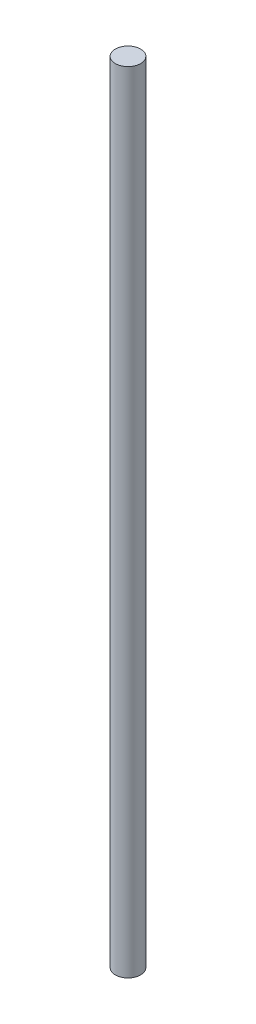
from build123d import *

# Parameters (mm, degrees)
SKETCH1_R           = 4
BOSS_EXTRUDE4_DEPTH = 250


with BuildPart() as part:
    # Sketch1 → Boss-Extrude4 (new body)
    with BuildSketch(Plane(origin=(0, 0, 0), x_dir=(1, 0, 0), z_dir=(0, 1, 0))):
        with Locations(Location((0, 0, 0), (0, 0, 270))):
            Circle(SKETCH1_R)
    extrude(amount=BOSS_EXTRUDE4_DEPTH)


solid = part.part
